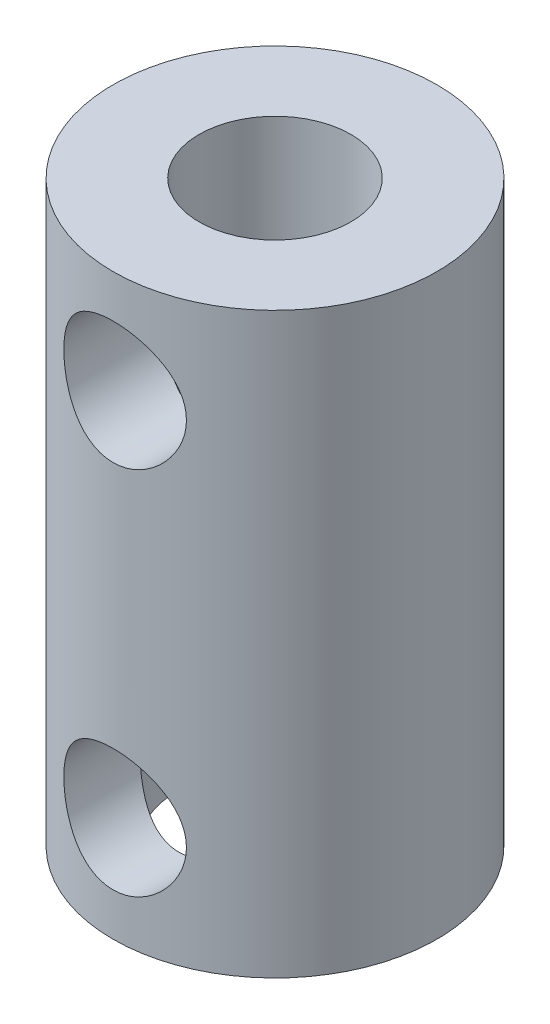
from build123d import *

# Parameters (mm, degrees)
SKETCH1_W                        = 5.334
SKETCH1_H                        = 19.05
F_21_0_159_DIAMETER_HOLE1_REACH  = 21.654
F_21_0_159_DIAMETER_HOLE1_BORE_R = 2.0193
F_21_0_159_DIAMETER_HOLE2_REACH  = 21.654
F_21_0_159_DIAMETER_HOLE2_BORE_R = 2.0193


with BuildPart() as part:
    # Sketch1 → Revolve1 (revolve)
    with BuildSketch(Plane.XY, mode=Mode.PRIVATE) as revolve1_sk:
        with Locations((2.667, 9.525)):
            Rectangle(SKETCH1_W, SKETCH1_H)
    revolve(revolve1_sk.sketch.rotate(Axis((0, 19.05, 0), (0, -1, 0)), 270), axis=Axis((0, 19.05, 0), (0, -1, 0)))

    # Sketch2 → CSK for #10 Flat Head Machine Screw (100)1 (revolve, cut)
    with BuildSketch(Plane(origin=(0, 0, 0), x_dir=(0, 0, -1), z_dir=(1, 0, 0))):
        Polygon((0, 0), (0, 19.05), (2.5, 19.05), (2.5, 9.930580918), (3.175, 9.525), (3.175, 0), align=None)
    revolve(axis=Axis((0, -6.35, 0), (0, 1, 0)), mode=Mode.SUBTRACT)

    # #21 (0.159) Diameter Hole1 bore (on position points) → #21 (0.159) Diameter Hole1 (cut, up to next)
    with BuildSketch(Plane(origin=(0, 15.621, 5.334), x_dir=(1, 0, 0), z_dir=(0, 0, 1)), mode=Mode.PRIVATE) as f_21_0_159_diameter_hole1_sk1:
        Circle(F_21_0_159_DIAMETER_HOLE1_BORE_R)
    f_21_0_159_diameter_hole1_tool1 = extrude(f_21_0_159_diameter_hole1_sk1.sketch, amount=-F_21_0_159_DIAMETER_HOLE1_REACH, mode=Mode.PRIVATE) & part.part
    add(f_21_0_159_diameter_hole1_tool1.solids().sort_by_distance((0, 15.621, 5.334))[0], mode=Mode.SUBTRACT)

    # #21 (0.159) Diameter Hole2 bore (on position points) → #21 (0.159) Diameter Hole2 (cut, up to next)
    with BuildSketch(Plane(origin=(0, 3.429, 5.334), x_dir=(1, 0, 0), z_dir=(0, 0, 1)), mode=Mode.PRIVATE) as f_21_0_159_diameter_hole2_sk1:
        Circle(F_21_0_159_DIAMETER_HOLE2_BORE_R)
    f_21_0_159_diameter_hole2_tool1 = extrude(f_21_0_159_diameter_hole2_sk1.sketch, amount=-F_21_0_159_DIAMETER_HOLE2_REACH, mode=Mode.PRIVATE) & part.part
    add(f_21_0_159_diameter_hole2_tool1.solids().sort_by_distance((0, 3.429, 5.334))[0], mode=Mode.SUBTRACT)


solid = part.part
